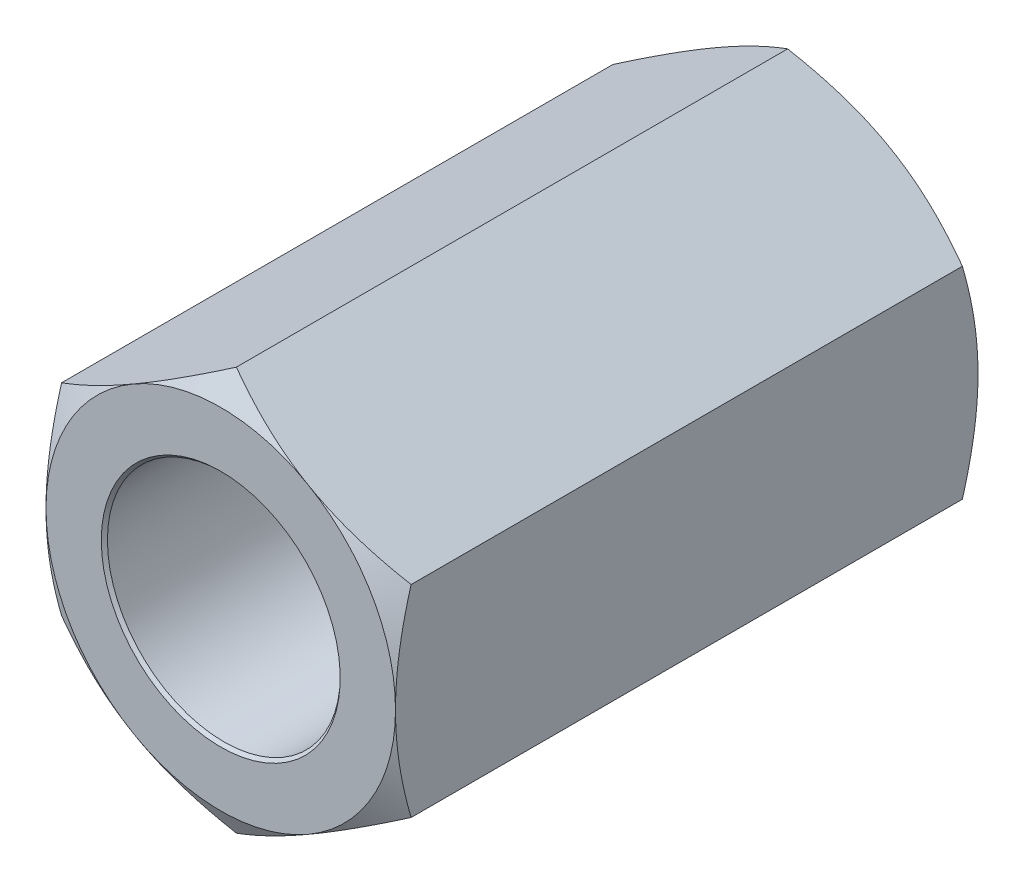
from build123d import *

# Parameters (mm, degrees)
EXTRUDE1_DEPTH          = 5
EXTRUDE1_DEPTH_BACK     = 5
SKETCH1_R               = 2
SKETCH8_OUTSIDE_W       = 52.282
SKETCH8_OUTSIDE_H       = 53.21
SKETCH8_OUTSIDE_R       = 3
EXTRUDE4_DEPTH          = 12
EXTRUDE4_DRAFT          = -60
MIRROR1_COPY_1_SKETCH_W = 52.282
MIRROR1_COPY_1_SKETCH_H = 53.21
MIRROR1_COPY_1_SKETCH_R = 3
MIRROR1_COPY_1_DEPTH    = 12
MIRROR1_COPY_1_DRAFT    = -60


with BuildPart() as part:
    # Sketch1 → Extrude1 (new, two sides: drawn at the far end of the back side and taken through both)
    with BuildSketch(Plane.XY.offset(-EXTRUDE1_DEPTH_BACK)):
        Polygon((0, 3.464101615), (-3, 1.732050808), (-3, -1.732050808), (0, -3.464101615), (3, -1.732050808), (3, 1.732050808), align=None)
        Circle(SKETCH1_R, mode=Mode.SUBTRACT)
    extrude(amount=EXTRUDE1_DEPTH + EXTRUDE1_DEPTH_BACK)

    # Extrude3 cone 1 section (through the dimple's axis) → Extrude3 (revolve, cut)
    with BuildSketch(Plane(origin=(0, 0, -5), x_dir=(0, 1, 0), z_dir=(1, 0, 0))):
        Polygon((0, 0), (2.0508, 0), (0, 2.199213751), align=None)
    extrude3 = revolve(axis=Axis((0, 0, -5), (0, 0, 1)), mode=Mode.SUBTRACT)


with BuildPart() as extrude4_tool:
    # Sketch8 outside → Extrude4 (with draft: the straight prism first)
    with BuildSketch(Plane(origin=(0, 0, -5), x_dir=(-1, 0, 0), z_dir=(0, 0, -1))):
        Rectangle(SKETCH8_OUTSIDE_W, SKETCH8_OUTSIDE_H)
        Circle(SKETCH8_OUTSIDE_R, mode=Mode.SUBTRACT)
    extrude(amount=-EXTRUDE4_DEPTH)
    # Extrude4: the draft: its side faces are tilted about the plane it starts from
    extrude4_sides = [extrude4_tool.faces().sort_by_distance(p)[0] for p in [
        (0, -26.605, 1),
        (-26.141, 0, 1),
        (0, 26.605, 1),
        (26.141, 0, 1),
        (3, 0, 1),
    ]]
    draft(extrude4_sides, Plane(origin=(0, 0, -5), x_dir=(-1, 0, 0), z_dir=(0, 0, -1)), EXTRUDE4_DRAFT)


with BuildPart() as part_1:
    add(part.part)

    # Extrude4: cut by extrude4_tool
    add(extrude4_tool.part, mode=Mode.SUBTRACT)

    # Mirror1: Extrude3 across plane
    add(extrude3.mirror(Plane.XY), mode=Mode.SUBTRACT)


with BuildPart() as mirror1_copy_1_tool:
    # Mirror1 copy 1 sketch → Mirror1 copy 1 (with draft: the straight prism first)
    with BuildSketch(Plane(origin=(0, 0, 5), x_dir=(-1, 0, 0), z_dir=(0, 0, 1))):
        Rectangle(MIRROR1_COPY_1_SKETCH_W, MIRROR1_COPY_1_SKETCH_H)
        Circle(MIRROR1_COPY_1_SKETCH_R, mode=Mode.SUBTRACT)
    extrude(amount=-MIRROR1_COPY_1_DEPTH)
    # Mirror1 copy 1: the draft: its side faces are tilted about the plane it starts from
    mirror1_copy_1_sides = [mirror1_copy_1_tool.faces().sort_by_distance(p)[0] for p in [
        (0, -26.605, -1),
        (-26.141, 0, -1),
        (0, 26.605, -1),
        (26.141, 0, -1),
        (3, 0, -1),
    ]]
    draft(mirror1_copy_1_sides, Plane(origin=(0, 0, 5), x_dir=(-1, 0, 0), z_dir=(0, 0, 1)), MIRROR1_COPY_1_DRAFT)


with BuildPart() as part_2:
    add(part_1.part)

    # Mirror1 copy 1: cut by mirror1_copy_1_tool
    add(mirror1_copy_1_tool.part, mode=Mode.SUBTRACT)


solid = part_2.part
